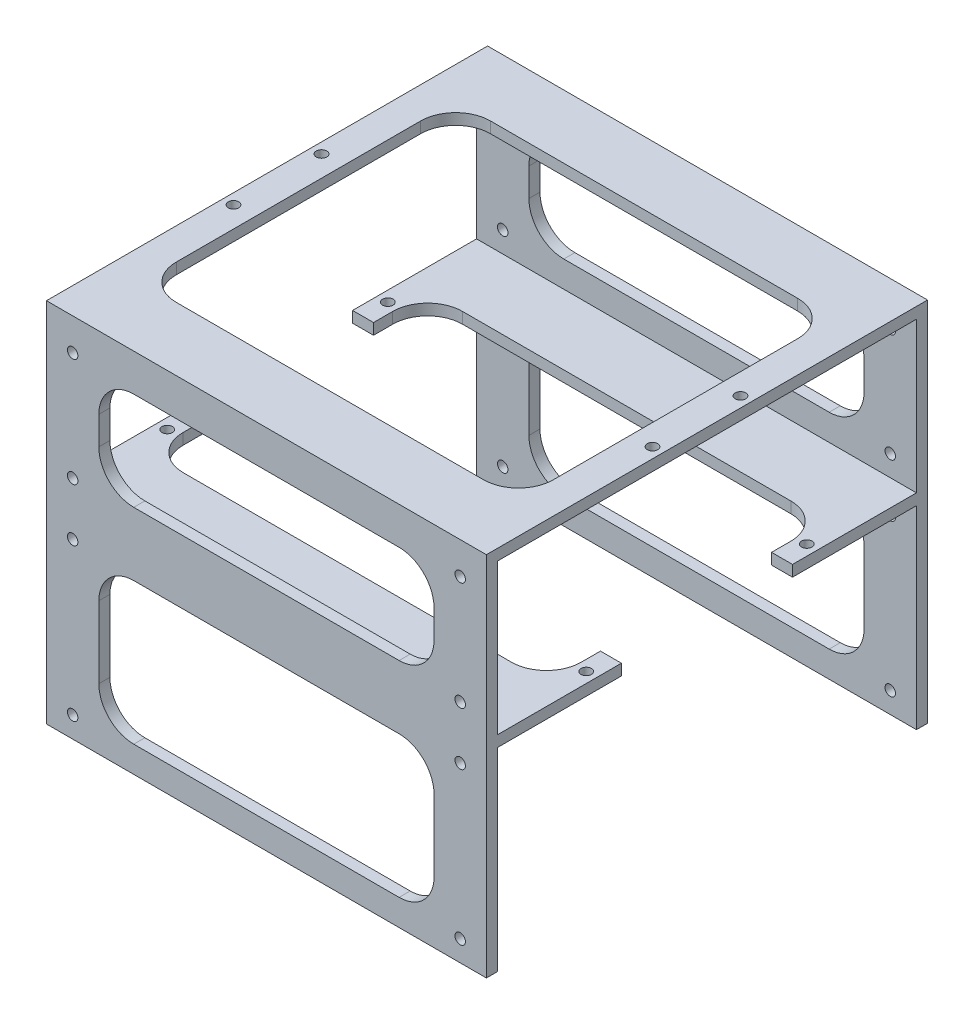
from build123d import *

# Parameters (mm, degrees)
BOSS_EXTRUDE1_DEPTH     = 126
SKETCH2_R               = 1.5
CUT_EXTRUDE1_DEPTH      = 46.25
SKETCH3_R               = 1.5
CUT_EXTRUDE3_DEPTH      = 53.75
CUT_EXTRUDE6_DEPTH      = 46.25
SKETCH5_W               = 120
SKETCH5_H               = 5
SKETCH5_H_2             = 0.575
SKETCH5_W_2             = 35.5
CUT_EXTRUDE7_DEPTH      = 188.549070389
CUT_EXTRUDE8_DEPTH      = 201.864965658
CUT_EXTRUDE8_DEPTH_BACK = 201.864965658
CUT_EXTRUDE9_DEPTH      = 203.827454511
CUT_EXTRUDE9_DEPTH_BACK = 203.827454511
SKETCH7_R               = 1.5
SKETCH8_W               = 1
SKETCH8_H               = 3.175
BOSS_EXTRUDE2_DEPTH     = 126


with BuildPart() as part:
    # Sketch1 → Boss-Extrude1 (new body)
    with BuildSketch(Plane(origin=(0, 0, 0), x_dir=(0, 0, -1), z_dir=(1, 0, 0))):
        Polygon((-95, -3.570472346), (-95, 46.429527654), (-59.5, 46.429527654), (-59.5, 50.179527654), (-95, 50.179527654), (-95, 92.679527654), (-43.5, 92.679527654), (-35, 92.679527654), (-35, 96.429527654), (-43.5, 96.429527654), (-90, 96.429527654), (-100, 96.429527654), (-100, 86.429527654), (-100, -8.570472346), (-90, -8.570472346), (-35, -8.570472346), (-35, -3.570472346), align=None)
    boss_extrude1 = extrude(amount=BOSS_EXTRUDE1_DEPTH)

    # Sketch2 → Cut-Extrude1 (cut)
    with BuildSketch(Plane(origin=(0, 96.429527654, 0), x_dir=(1, 0, 0), z_dir=(0, 1, 0))):
        with Locations(Location((3, -47.6, 0), (0, 0, 270))):
            Circle(SKETCH2_R)
        with Locations(Location((123, -47.6, 0), (0, 0, 270))):
            Circle(SKETCH2_R)
    cut_extrude1 = extrude(amount=-CUT_EXTRUDE1_DEPTH, mode=Mode.SUBTRACT)

    # Sketch3 → Cut-Extrude3 (cut)
    with BuildSketch(Plane(origin=(0, 50.179527654, 0), x_dir=(1, 0, 0), z_dir=(0, 1, 0))):
        with Locations(Location((3, -66.6, 0), (0, 0, 270))):
            Circle(SKETCH3_R)
        with Locations(Location((123, -66.6, 0), (0, 0, 270))):
            Circle(SKETCH3_R)
        with BuildLine():
            Line((6, -65), (6, -35))
            Line((6, -35), (120, -35))
            Line((120, -35), (120, -65))
            ThreePointArc((120, -65), (117.071067812, -72.071067812), (110, -75))
            Line((110, -75), (16, -75))
            ThreePointArc((16, -75), (8.928932188, -72.071067812), (6, -65))
        make_face()
    cut_extrude3 = extrude(amount=-CUT_EXTRUDE3_DEPTH, mode=Mode.SUBTRACT)

    # Mirror2: Boss-Extrude1, Cut-Extrude1, Cut-Extrude3 across plane
    add(boss_extrude1.mirror(Plane(origin=(0, 0, 35), x_dir=(1, 0, 0), z_dir=(0, 0, -1))))
    add(cut_extrude1.mirror(Plane(origin=(0, 0, 35), x_dir=(1, 0, 0), z_dir=(0, 0, -1))), mode=Mode.SUBTRACT)
    add(cut_extrude3.mirror(Plane(origin=(0, 0, 35), x_dir=(1, 0, 0), z_dir=(0, 0, -1))), mode=Mode.SUBTRACT)

    # Sketch4 → Cut-Extrude6 (cut)
    with BuildSketch(Plane(origin=(0, 96.429527654, 0), x_dir=(1, 0, 0), z_dir=(0, 1, 0))):
        with BuildLine():
            Line((9, -35), (9, -70))
            ThreePointArc((9, -70), (11.928932188, -77.071067812), (19, -80))
            Line((19, -80), (106.999682888, -80))
            ThreePointArc((106.999682888, -80), (114.0707507, -77.071067812), (116.999682888, -70))
            Line((116.999682888, -70), (116.999682888, -35))
            Line((116.999682888, -35), (9, -35))
        make_face()
    cut_extrude6 = extrude(amount=-CUT_EXTRUDE6_DEPTH, mode=Mode.SUBTRACT)

    # Mirror5: Cut-Extrude6 across plane
    add(cut_extrude6.mirror(Plane(origin=(0, 0, 35), x_dir=(1, 0, 0), z_dir=(0, 0, -1))), mode=Mode.SUBTRACT)

    # Sketch5 → Cut-Extrude7 (cut, through all)
    with BuildSketch(Plane(origin=(126, 0, 0), x_dir=(0, 0, -1), z_dir=(1, 0, 0))):
        with Locations((-35, -6.070472346)):
            Rectangle(SKETCH5_W, SKETCH5_H)
        Polygon((-100, 96.429527654), (-98.175, 96.429527654), (-97.175, 96.429527654), (-97.175, 93.254527654), (-98.175, 93.254527654), (-98.175, -8.570472346), (-100, -8.570472346), align=None)
        with Locations((-35, 92.967027654)):
            Rectangle(SKETCH5_W, SKETCH5_H_2)
        with Locations((-77.25, 46.717027654)):
            Rectangle(SKETCH5_W_2, SKETCH5_H_2)
        with Locations((7.25, 46.717027654)):
            Rectangle(SKETCH5_W_2, SKETCH5_H_2)
        Polygon((28.175, 93.254527654), (28.175, -8.570472346), (30, -8.570472346), (30, 96.429527654), (28.175, 96.429527654), (27.175, 96.429527654), (27.175, 93.254527654), align=None)
    extrude(amount=-CUT_EXTRUDE7_DEPTH, mode=Mode.SUBTRACT)

    # Sketch6 → Cut-Extrude8 (cut, two sides: drawn at the far end of the back side and taken through both)
    with BuildSketch(Plane(origin=(0, 0, 95), x_dir=(-1, 0, 0), z_dir=(0, 0, -1)).offset(-CUT_EXTRUDE8_DEPTH_BACK)):
        with BuildLine():
            Line((-100.999841444, 85.754527654), (-25, 85.754527654))
            ThreePointArc((-25, 85.754527654), (-17.928932188, 82.825595466), (-15, 75.754527654))
            Line((-15, 75.754527654), (-15, 67.679527654))
            ThreePointArc((-15, 67.679527654), (-17.928932188, 60.608459842), (-25, 57.679527654))
            Line((-25, 57.679527654), (-100.999841444, 57.679527654))
            ThreePointArc((-100.999841444, 57.679527654), (-108.070909256, 60.608459842), (-110.999841444, 67.679527654))
            Line((-110.999841444, 67.679527654), (-110.999841444, 75.754527654))
            ThreePointArc((-110.999841444, 75.754527654), (-108.070909256, 82.825595466), (-100.999841444, 85.754527654))
        make_face()
        with BuildLine():
            Line((-101, 39.504527654), (-25, 39.504527654))
            ThreePointArc((-25, 39.504527654), (-17.928932188, 36.575595466), (-15, 29.504527654))
            Line((-15, 29.504527654), (-15, 8.929527654))
            ThreePointArc((-15, 8.929527654), (-17.928932188, 1.858459842), (-25, -1.070472346))
            Line((-25, -1.070472346), (-101, -1.070472346))
            ThreePointArc((-101, -1.070472346), (-108.071067812, 1.858459842), (-111, 8.929527654))
            Line((-111, 8.929527654), (-111, 29.504527654))
            ThreePointArc((-111, 29.504527654), (-108.071067812, 36.575595466), (-101, 39.504527654))
        make_face()
    extrude(amount=CUT_EXTRUDE8_DEPTH + CUT_EXTRUDE8_DEPTH_BACK, mode=Mode.SUBTRACT)

    # Sketch7 → Cut-Extrude9 (cut, two sides: drawn at the far end of the back side and taken through both)
    with BuildSketch(Plane.XY.offset(98.175).offset(-CUT_EXTRUDE9_DEPTH_BACK)):
        with Locations((118.5, 87.254527654)):
            Circle(SKETCH7_R)
        with Locations((118.5, 56.179527654)):
            Circle(SKETCH7_R)
        with Locations((118.5, 41.004527654)):
            Circle(SKETCH7_R)
        with Locations((118.5, -2.570472346)):
            Circle(SKETCH7_R)
        with Locations(Location((7.5, -2.570472346, 0), (0, 0, 90))):
            Circle(SKETCH7_R)
        with Locations(Location((7.5, 41.004527654, 0), (0, 0, 90))):
            Circle(SKETCH7_R)
        with Locations(Location((7.5, 56.179527654, 0), (0, 0, 180))):
            Circle(SKETCH7_R)
        with Locations(Location((7.5, 87.254527654, 0), (0, 0, 180))):
            Circle(SKETCH7_R)
    extrude(amount=CUT_EXTRUDE9_DEPTH + CUT_EXTRUDE9_DEPTH_BACK, mode=Mode.SUBTRACT)

    # Sketch8 → Boss-Extrude2 (add)
    with BuildSketch(Plane(origin=(126, 0, 0), x_dir=(0, 0, -1), z_dir=(1, 0, 0))):
        with Locations((-97.675, 94.842027654)):
            Rectangle(SKETCH8_W, SKETCH8_H)
        with Locations((27.675, 94.842027654)):
            Rectangle(SKETCH8_W, SKETCH8_H)
    extrude(amount=-BOSS_EXTRUDE2_DEPTH)


solid = part.part
